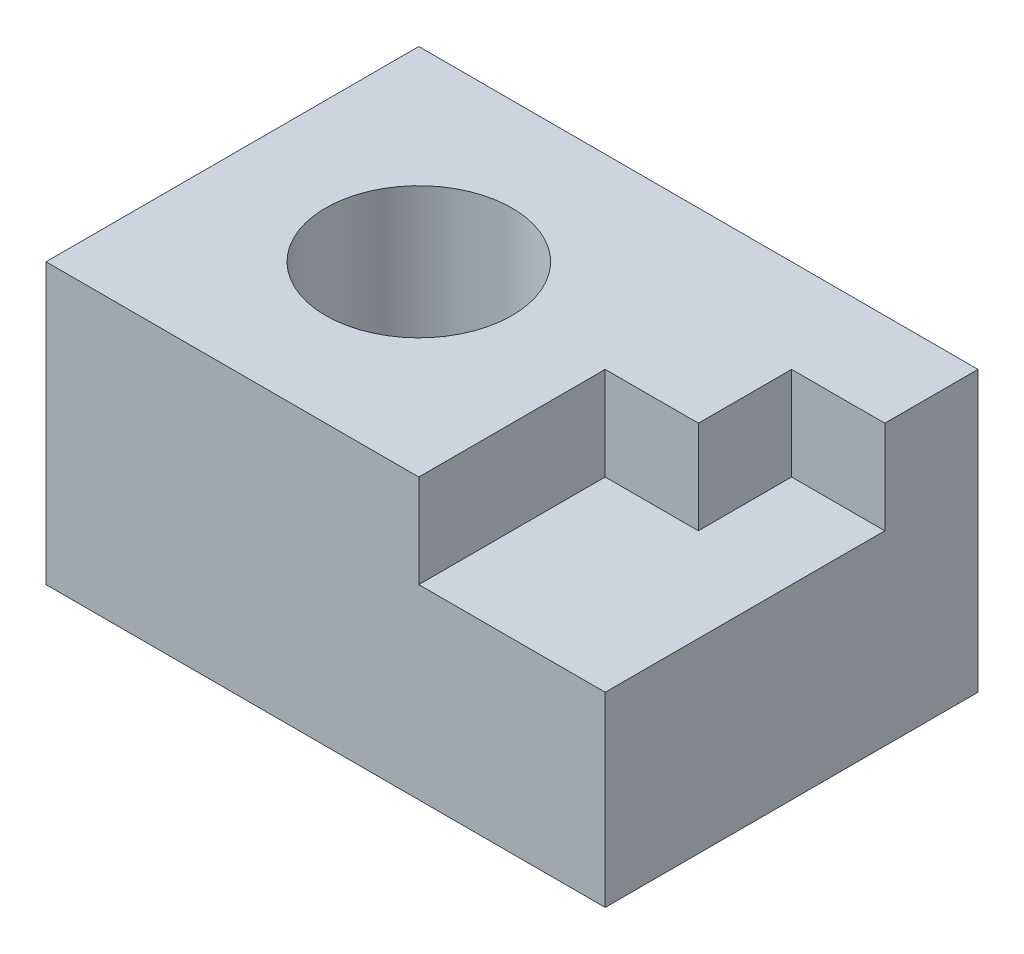
from build123d import *

# Parameters (mm, degrees)
SKETCH1_W           = 152.4
SKETCH1_H           = 101.6
BOSS_EXTRUDE1_DEPTH = 76.2
CUT_EXTRUDE3_DEPTH  = 25.4
SKETCH3_R           = 25.4
CUT_EXTRUDE4_DEPTH  = 199.380341768


with BuildPart() as part:
    # Sketch1 → Boss-Extrude1 (new body)
    with BuildSketch(Plane(origin=(0, 0, 0), x_dir=(1, 0, 0), z_dir=(0, 1, 0))):
        with Locations((76.2, 50.8)):
            Rectangle(SKETCH1_W, SKETCH1_H)
    extrude(amount=BOSS_EXTRUDE1_DEPTH)

    # Sketch2 → Cut-Extrude3 (cut)
    with BuildSketch(Plane(origin=(0, 76.2, 0), x_dir=(1, 0, 0), z_dir=(0, 1, 0))):
        Polygon((101.6, 0), (101.6, 50.8), (127, 50.8), (127, 76.2), (152.4, 76.2), (152.4, 0), align=None)
    extrude(amount=-CUT_EXTRUDE3_DEPTH, mode=Mode.SUBTRACT)

    # Sketch3 → Cut-Extrude4 (cut, through all)
    with BuildSketch(Plane(origin=(0, 76.2, 0), x_dir=(1, 0, 0), z_dir=(0, 1, 0))):
        with Locations(Location((50.8, 50.8, 0), (0, 0, 270))):
            Circle(SKETCH3_R)
    extrude(amount=-CUT_EXTRUDE4_DEPTH, mode=Mode.SUBTRACT)


solid = part.part
